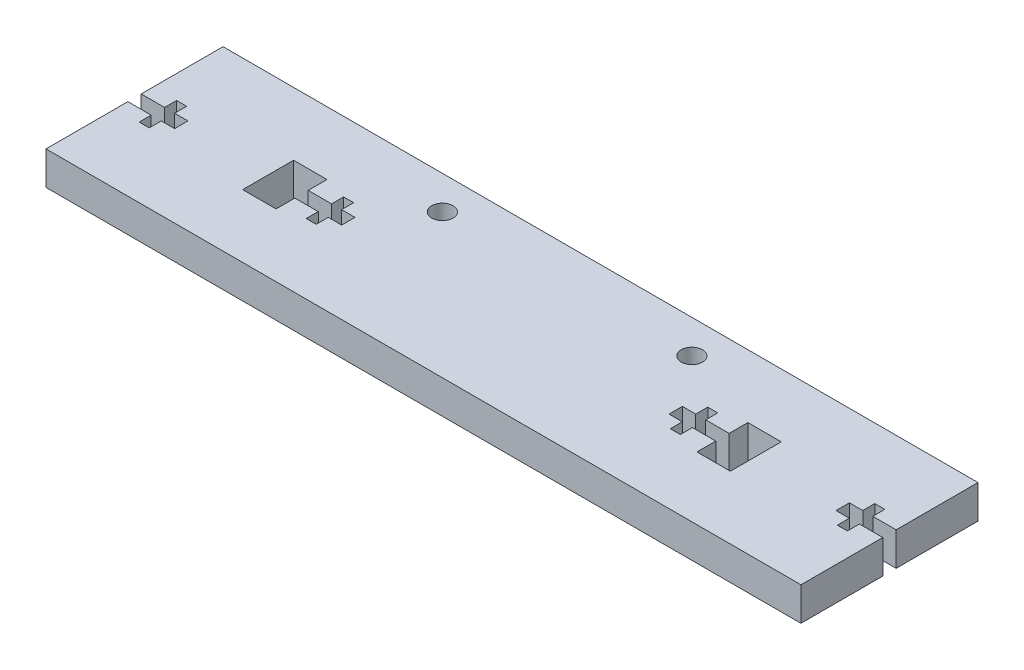
from build123d import *

# Parameters (mm, degrees)
ESBO_O1_W                = 113
ESBO_O1_H                = 26.5
RESSALTO_EXTRUS_O1_DEPTH = 5
ESBO_O2_W                = 5
ESBO_O2_H                = 7.62
CORTE_EXTRUS_O1_DEPTH    = 5
CORTE_EXTRUS_O2_DEPTH    = 5
ESBO_O4_R                = 1.6
CORTE_EXTRUS_O3_DEPTH    = 10


with BuildPart() as part:
    # Esboço1 → Ressalto-extrusão1 (new body)
    with BuildSketch(Plane(origin=(0, 0, 0), x_dir=(1, 0, 0), z_dir=(0, 1, 0))):
        with Locations((-20.23644711, -18.909257917)):
            Rectangle(ESBO_O1_W, ESBO_O1_H)
    extrude(amount=RESSALTO_EXTRUS_O1_DEPTH)

    # Esboço2 → Corte-extrusão1 (cut)
    with BuildSketch(Plane(origin=(0, 5, 0), x_dir=(1, 0, 0), z_dir=(0, 1, 0))):
        with Locations((13.76355289, -18.914257917)):
            Rectangle(ESBO_O2_W, ESBO_O2_H)
        with Locations((-54.23644711, -18.914257917)):
            Rectangle(ESBO_O2_W, ESBO_O2_H)
    extrude(amount=-CORTE_EXTRUS_O1_DEPTH, mode=Mode.SUBTRACT)

    # Esboço3 → Corte-extrusão2 (cut)
    with BuildSketch(Plane(origin=(0, 5, 0), x_dir=(1, 0, 0), z_dir=(0, 1, 0))):
        Polygon((-76.73644711, -17.909257917), (-73.23644711, -17.909257917), (-73.23644711, -16.109257917), (-71.73644711, -16.109257917), (-71.73644711, -17.909257917), (-69.73644711, -17.909257917), (-69.73644711, -19.909257917), (-71.73644711, -19.909257917), (-71.73644711, -21.709257917), (-73.23644711, -21.709257917), (-73.23644711, -19.909257917), (-76.73644711, -19.909257917), align=None)
        Polygon((-51.73644711, -17.909257917), (-48.23644711, -17.909257917), (-48.23644711, -16.109257917), (-46.73644711, -16.109257917), (-46.73644711, -17.909257917), (-44.73644711, -17.909257917), (-44.73644711, -19.909257917), (-46.73644711, -19.909257917), (-46.73644711, -21.709257917), (-48.23644711, -21.709257917), (-48.23644711, -19.909257917), (-51.73644711, -19.909257917), align=None)
    corte_extrus_o2 = extrude(amount=-CORTE_EXTRUS_O2_DEPTH, mode=Mode.SUBTRACT)

    # Espelhar1: Corte-extrusão2 across plane
    add(corte_extrus_o2.mirror(Plane.ZY.offset(20.23644711)), mode=Mode.SUBTRACT)

    # Esboço4 → Corte-extrusão3 (cut)
    with BuildSketch(Plane(origin=(0, 0, 0), x_dir=(-1, 0, 0), z_dir=(0, -1, 0))):
        with Locations(Location((1.56644711, -10.659257917, 0), (0, 0, 90))):
            Circle(ESBO_O4_R)
        with Locations(Location((38.90644711, -10.659257917, 0), (0, 0, 90))):
            Circle(ESBO_O4_R)
    extrude(amount=-CORTE_EXTRUS_O3_DEPTH, mode=Mode.SUBTRACT)


solid = part.part
